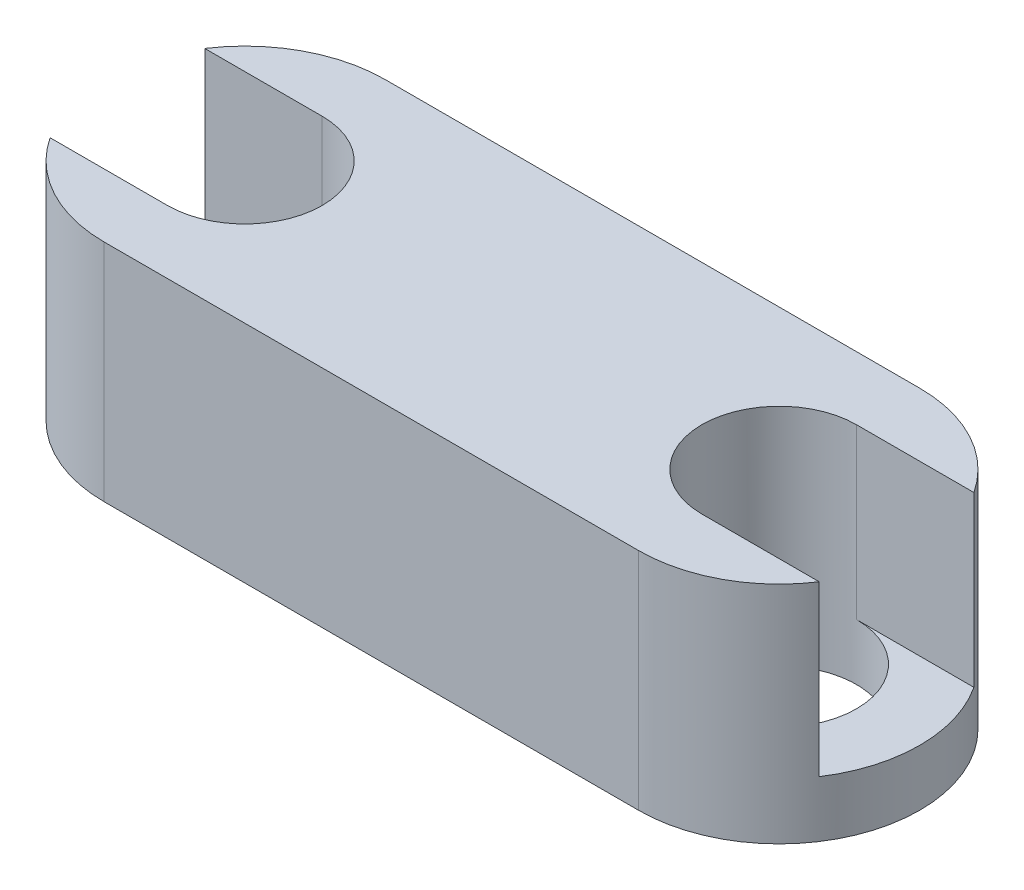
from build123d import *

# Parameters (mm, degrees)
SKETCH1_R           = 2.75
BOSS_EXTRUDE1_DEPTH = 8
SKETCH2_W           = 9.846047084
SKETCH2_H           = 5.5
SKETCH2_W_2         = 9.846047083
CUT_EXTRUDE1_DEPTH  = 6


with BuildPart() as part:
    # Sketch1 → Boss-Extrude1 (new body)
    with BuildSketch(Plane(origin=(0, 0, 0), x_dir=(1, 0, 0), z_dir=(0, 1, 0))):
        with BuildLine():
            Line((-7.712527276, 6.5), (11.287472724, 6.5))
            ThreePointArc((11.287472724, 6.5), (16.287472724, 1.5), (11.287472724, -3.5))
            Line((11.287472724, -3.5), (-7.712527276, -3.5))
            ThreePointArc((-7.712527276, -3.5), (-12.712527276, 1.5), (-7.712527276, 6.5))
        make_face()
        with Locations(Location((-7.712527276, 1.5, 0), (0, 0, 270))):
            Circle(SKETCH1_R, mode=Mode.SUBTRACT)
        with Locations(Location((11.287472724, 1.5, 0), (0, 0, 270))):
            Circle(SKETCH1_R, mode=Mode.SUBTRACT)
    extrude(amount=BOSS_EXTRUDE1_DEPTH)

    # Sketch2 → Cut-Extrude1 (cut)
    with BuildSketch(Plane(origin=(0, 8, 0), x_dir=(1, 0, 0), z_dir=(0, 1, 0))):
        with Locations((-12.635550818, 1.5)):
            Rectangle(SKETCH2_W, SKETCH2_H)
        with Locations((16.210496266, 1.5)):
            Rectangle(SKETCH2_W_2, SKETCH2_H)
    extrude(amount=-CUT_EXTRUDE1_DEPTH, mode=Mode.SUBTRACT)


solid = part.part
